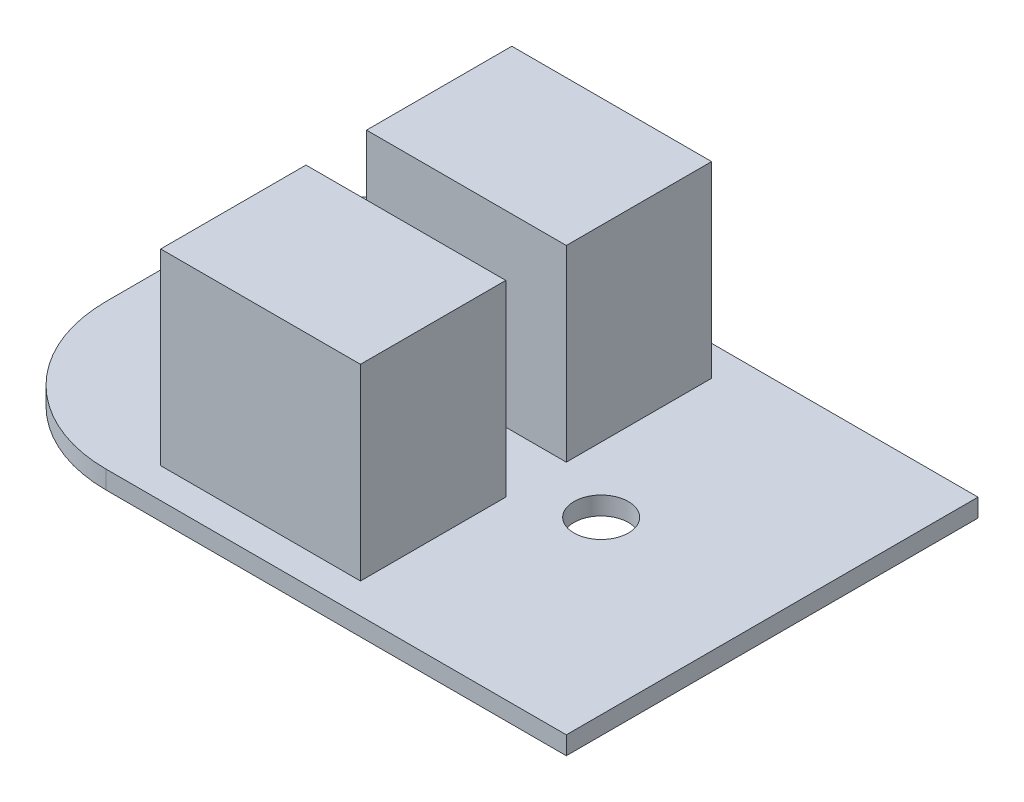
from build123d import *

# Parameters (mm, degrees)
SKETCH1_W           = 50
SKETCH1_H           = 34
BOSS_EXTRUDE1_DEPTH = 1.5
FILLET1_R           = 12
SKETCH2_R           = 2.25
CUT_EXTRUDE1_DEPTH  = 1.5
SKETCH3_W           = 16.5
SKETCH3_H           = 12
BOSS_EXTRUDE2_DEPTH = 15.5


with BuildPart() as part:
    # Sketch1 → Boss-Extrude1 (new body)
    with BuildSketch(Plane(origin=(0, 0, 0), x_dir=(1, 0, 0), z_dir=(0, 1, 0))):
        with Locations((25, -17)):
            Rectangle(SKETCH1_W, SKETCH1_H)
    extrude(amount=BOSS_EXTRUDE1_DEPTH)

    # Fillet1
    fillet1_edges = [part.edges().sort_by_distance(p)[0] for p in [
        (0, 0.75, 0),
        (0, 0.75, 34),
    ]]
    fillet(fillet1_edges, radius=FILLET1_R)

    # Sketch2 → Cut-Extrude1 (cut)
    with BuildSketch(Plane(origin=(0, 1.5, 0), x_dir=(1, 0, 0), z_dir=(0, 1, 0))):
        with Locations(Location((8.04, -17, 0), (0, 0, 270))):
            Circle(SKETCH2_R)
        with Locations(Location((35.88, -17, 0), (0, 0, 270))):
            Circle(SKETCH2_R)
    extrude(amount=-CUT_EXTRUDE1_DEPTH, mode=Mode.SUBTRACT)

    # Sketch3 → Boss-Extrude2 (add)
    with BuildSketch(Plane(origin=(0, 1.5, 0), x_dir=(1, 0, 0), z_dir=(0, 1, 0))):
        with Locations((22.25, -8.5)):
            Rectangle(SKETCH3_W, SKETCH3_H)
        with Locations((22.25, -25.5)):
            Rectangle(SKETCH3_W, SKETCH3_H)
    extrude(amount=BOSS_EXTRUDE2_DEPTH)


solid = part.part
